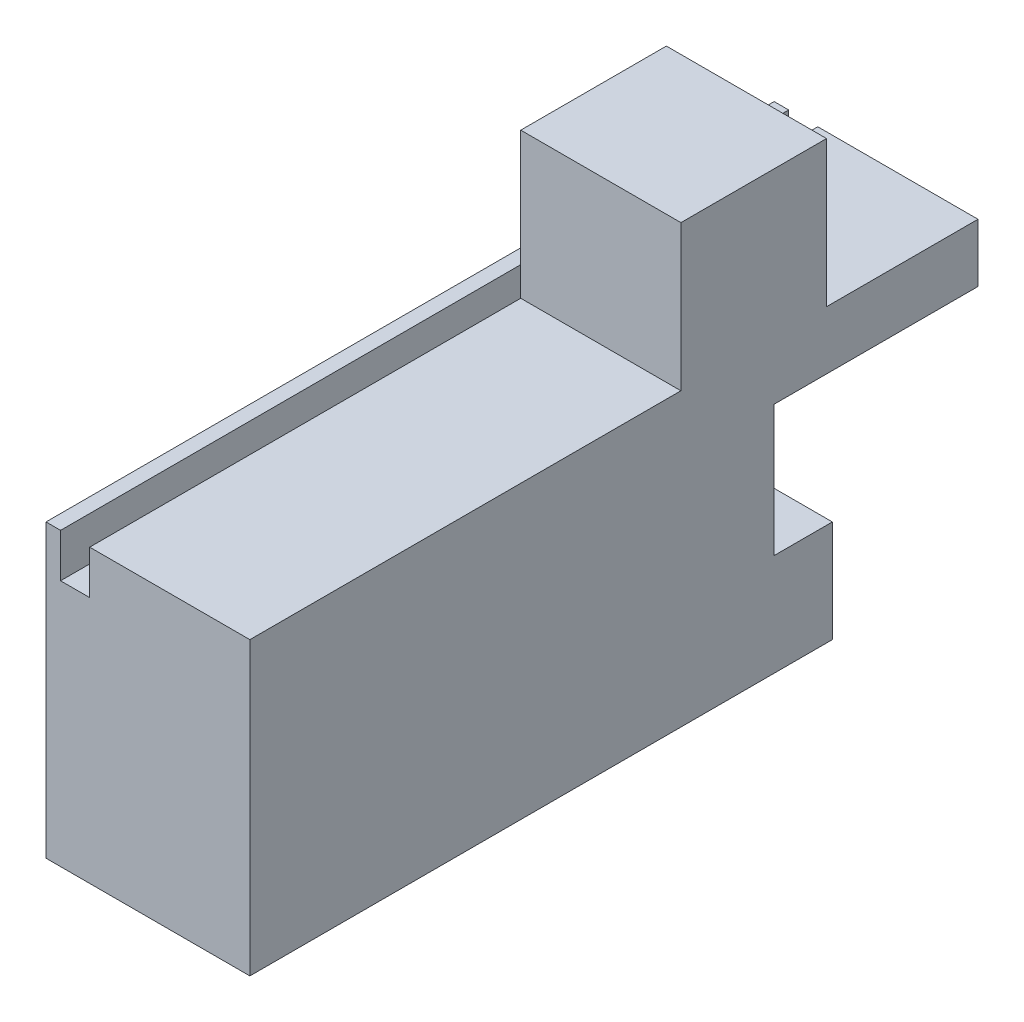
from build123d import *

# Parameters (mm, degrees)
BOSS_EXTRUDE1_DEPTH = 50
SKETCH2_W           = 50
SKETCH2_H           = 4
BOSS_EXTRUDE2_DEPTH = 10
SKETCH4_W           = 14
SKETCH4_H           = 36
BOSS_EXTRUDE3_DEPTH = 16
SKETCH5_W           = 14
SKETCH5_H           = 7
BOSS_EXTRUDE4_DEPTH = 4
SKETCH7_W           = 10
SKETCH7_H           = 10
BOSS_EXTRUDE5_DEPTH = 11
SKETCH8_R           = 0.4
CUT_EXTRUDE2_DEPTH  = 7


with BuildPart() as part:
    # Sketch1 → Boss-Extrude1 (new body)
    with BuildSketch(Plane.XY):
        Polygon((0, 0), (2, 0), (2, 3), (3, 3), (3, -1), (-1, -1), (-1, 3), (0, 3), align=None)
    extrude(amount=BOSS_EXTRUDE1_DEPTH)

    # Sketch2 → Boss-Extrude2 (add)
    with BuildSketch(Plane(origin=(3, 0, 0), x_dir=(0, 0, -1), z_dir=(1, 0, 0))):
        with Locations((-25, 1)):
            Rectangle(SKETCH2_W, SKETCH2_H)
    extrude(amount=BOSS_EXTRUDE2_DEPTH)

    # Sketch4 → Boss-Extrude3 (add)
    with BuildSketch(Plane.XZ.offset(1)):
        with Locations((6, 32)):
            Rectangle(SKETCH4_W, SKETCH4_H)
    extrude(amount=BOSS_EXTRUDE3_DEPTH)

    # Sketch5 → Boss-Extrude4 (add)
    with BuildSketch(Plane(origin=(0, 0, 14), x_dir=(-1, 0, 0), z_dir=(0, 0, -1))):
        with Locations((-6, -13.5)):
            Rectangle(SKETCH5_W, SKETCH5_H)
    extrude(amount=BOSS_EXTRUDE4_DEPTH)

    # Sketch7 → Boss-Extrude5 (add)
    with BuildSketch(Plane(origin=(13, 0, 0), x_dir=(0, 0, -1), z_dir=(1, 0, 0))):
        with Locations((-15.4, 8)):
            Rectangle(SKETCH7_W, SKETCH7_H)
    extrude(amount=-BOSS_EXTRUDE5_DEPTH)

    # Sketch8 → Cut-Extrude2 (cut)
    with BuildSketch(Plane.ZY.offset(-2)):
        with Locations((15.4, 10.1)):
            Circle(SKETCH8_R)
    extrude(amount=-CUT_EXTRUDE2_DEPTH, mode=Mode.SUBTRACT)


solid = part.part
